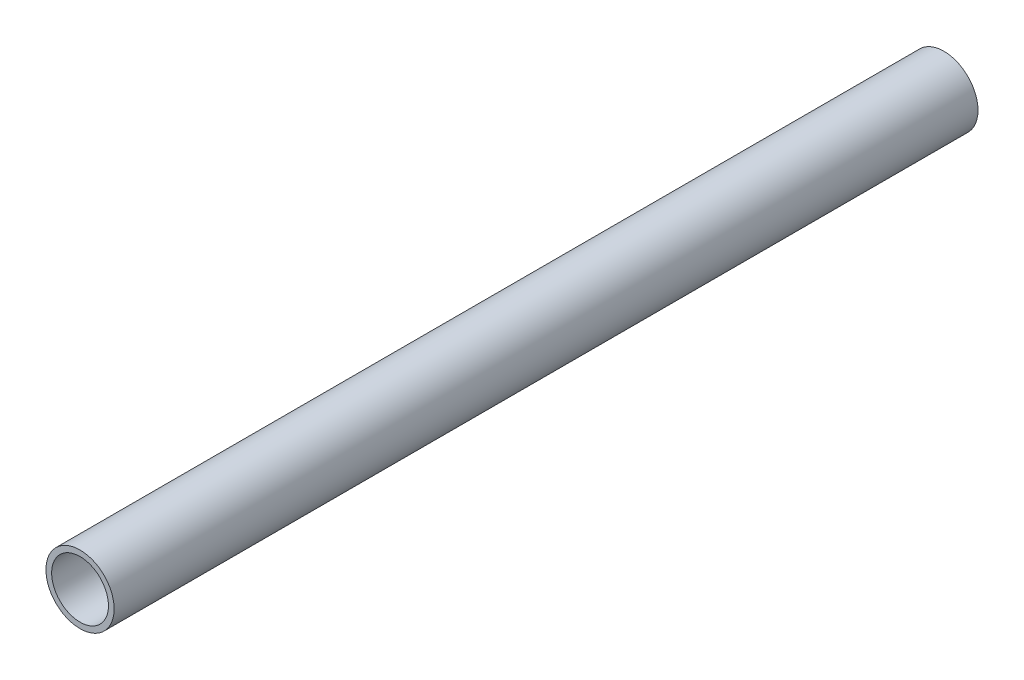
from build123d import *

# Parameters (mm, degrees)
SKETCH1_R       = 1.5
SKETCH1_R_2     = 1.25
BODY_TUBE_DEPTH = 37.9984


with BuildPart() as part:
    # Sketch1 → body tube (new body)
    with BuildSketch(Plane.XY):
        Circle(SKETCH1_R)
        Circle(SKETCH1_R_2, mode=Mode.SUBTRACT)
    extrude(amount=BODY_TUBE_DEPTH)


solid = part.part
